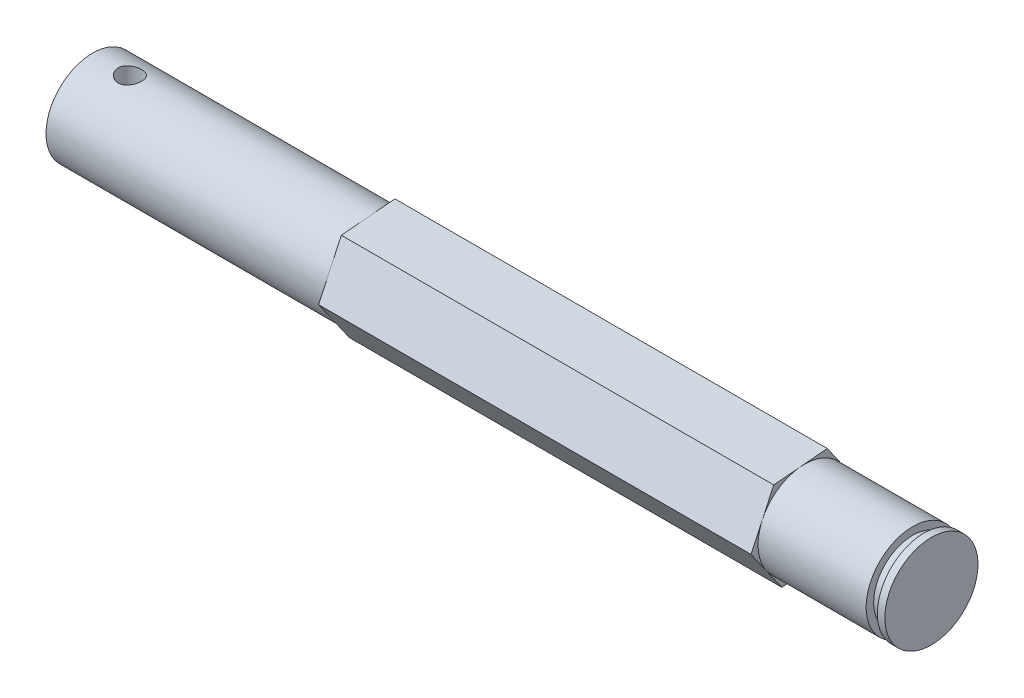
from build123d import *

# Parameters (mm, degrees)
BOSS_EXTRUDE1_DEPTH     = 38.1
SKETCH3_R               = 3.175
BOSS_EXTRUDE3_DEPTH     = 19.05
CUT_EXTRUDE1_DEPTH      = 39.418677326
CUT_EXTRUDE1_DEPTH_BACK = 39.418677326
SKETCH4_R               = 0.79375
CUT_EXTRUDE4_DEPTH      = 8.636
SKETCH6_OUTSIDE_W       = 20.904
SKETCH6_OUTSIDE_H       = 20.248
SKETCH6_OUTSIDE_R       = 2.667
CUT_EXTRUDE5_DEPTH      = 0.762


with BuildPart() as part:
    # Sketch1 → Boss-Extrude1 (new body)
    with BuildSketch(Plane(origin=(0, 0, 0), x_dir=(0, 0, -1), z_dir=(1, 0, 0))):
        Polygon((2.105028301, -3.00161443), (3.651988499, 0.32220077), (1.546960198, 3.323815199), (-2.105028301, 3.00161443), (-3.651988499, -0.32220077), (-1.546960198, -3.323815199), align=None)
    extrude(amount=BOSS_EXTRUDE1_DEPTH)

    # Sketch3 → Boss-Extrude3 (add)
    with BuildSketch(Plane.ZY):
        with Locations(Location((0, 0, 0), (0, 0, 204.958070598))):
            Circle(SKETCH3_R)
    extrude(amount=BOSS_EXTRUDE3_DEPTH)

    # Sketch4 → Cut-Extrude1 (cut, two sides: drawn at the far end of the back side and taken through both)
    with BuildSketch(Plane(origin=(0, 0, 0), x_dir=(1, 0, 0), z_dir=(0, 1, 0)).offset(-CUT_EXTRUDE1_DEPTH_BACK)):
        with Locations(Location((-16.51, 0, 0), (0, 0, 90))):
            Circle(SKETCH4_R)
    extrude(amount=CUT_EXTRUDE1_DEPTH + CUT_EXTRUDE1_DEPTH_BACK, mode=Mode.SUBTRACT)

    # Sketch5 → Cut-Extrude4 (cut)
    with BuildSketch(Plane(origin=(38.1, 0, 0), x_dir=(0, 0, -1), z_dir=(1, 0, 0))):
        with BuildLine():
            Line((-2.878508392, 1.339706848), (-2.105028301, 3.00161443))
            ThreePointArc((-2.105028301, 3.00161443), (-3.323815199, 1.546960198), (-3.651988499, -0.32220077))
            Line((-3.651988499, -0.32220077), (-2.878508392, 1.339706848))
        make_face()
        with BuildLine():
            Line((-2.878508392, 1.339706848), (-3.651988499, -0.32220077))
            Line((-3.651988499, -0.32220077), (-2.599474334, -1.823008005))
            ThreePointArc((-2.599474334, -1.823008005), (-3.162714814, -0.279034054), (-2.878508392, 1.339706848))
        make_face()
        with BuildLine():
            ThreePointArc((-3.651988499, -0.32220077), (-3.00161443, -2.105028301), (-1.546960198, -3.323815199))
            Line((-1.546960198, -3.323815199), (-2.599474334, -1.823008005))
            Line((-2.599474334, -1.823008005), (-3.651988499, -0.32220077))
        make_face()
        with BuildLine():
            Line((-2.599474334, -1.823008005), (-1.546960198, -3.323815199))
            Line((-1.546960198, -3.323815199), (0.279034067, -3.162714813))
            ThreePointArc((0.279034067, -3.162714813), (-1.339706811, -2.878508409), (-2.599474334, -1.823008005))
        make_face()
        with BuildLine():
            ThreePointArc((-1.546960198, -3.323815199), (0.32220077, -3.651988499), (2.105028301, -3.00161443))
            Line((2.105028301, -3.00161443), (0.279034067, -3.162714813))
            Line((0.279034067, -3.162714813), (-1.546960198, -3.323815199))
        make_face()
        with BuildLine():
            Line((0.279034067, -3.162714813), (2.105028301, -3.00161443))
            Line((2.105028301, -3.00161443), (2.878508392, -1.339706848))
            ThreePointArc((2.878508392, -1.339706848), (1.823007983, -2.59947435), (0.279034067, -3.162714813))
        make_face()
        with BuildLine():
            ThreePointArc((2.105028301, -3.00161443), (3.252555442, -1.69166085), (3.666174209, 0))
            ThreePointArc((3.666174209, 0), (3.662626065, 0.16125645), (3.651988499, 0.32220077))
            Line((3.651988499, 0.32220077), (2.878508392, -1.339706848))
            Line((2.878508392, -1.339706848), (2.105028301, -3.00161443))
        make_face()
        with BuildLine():
            Line((2.878508392, -1.339706848), (3.651988499, 0.32220077))
            Line((3.651988499, 0.32220077), (2.599474407, 1.823007901))
            ThreePointArc((2.599474407, 1.823007901), (3.027701789, 0.955848774), (3.175, 0))
            ThreePointArc((3.175, 0), (3.09999106, -0.686061534), (2.878508392, -1.339706848))
        make_face()
        with BuildLine():
            Line((2.599474407, 1.823007901), (3.651988499, 0.32220077))
            ThreePointArc((3.651988499, 0.32220077), (3.00161443, 2.105028301), (1.546960198, 3.323815199))
            Line((1.546960198, 3.323815199), (2.599474407, 1.823007901))
        make_face()
        with BuildLine():
            Line((2.599474407, 1.823007901), (1.546960198, 3.323815199))
            Line((1.546960198, 3.323815199), (-0.279034067, 3.162714813))
            ThreePointArc((-0.279034067, 3.162714813), (1.339706869, 2.878508382), (2.599474407, 1.823007901))
        make_face()
        with BuildLine():
            Line((-0.279034067, 3.162714813), (1.546960198, 3.323815199))
            ThreePointArc((1.546960198, 3.323815199), (-0.32220077, 3.651988499), (-2.105028301, 3.00161443))
            Line((-2.105028301, 3.00161443), (-0.279034067, 3.162714813))
        make_face()
        with BuildLine():
            Line((-0.279034067, 3.162714813), (-2.105028301, 3.00161443))
            Line((-2.105028301, 3.00161443), (-2.878508392, 1.339706848))
            ThreePointArc((-2.878508392, 1.339706848), (-1.823007983, 2.59947435), (-0.279034067, 3.162714813))
        make_face()
    extrude(amount=-CUT_EXTRUDE4_DEPTH, mode=Mode.SUBTRACT)

    # Sketch6 outside → Cut-Extrude5 (cut)
    with BuildSketch(Plane(origin=(36.83, 0, 0), x_dir=(0, 0, -1), z_dir=(1, 0, 0))):
        Rectangle(SKETCH6_OUTSIDE_W, SKETCH6_OUTSIDE_H)
        with Locations(Location((0, 0, 0), (0, 0, 180))):
            Circle(SKETCH6_OUTSIDE_R, mode=Mode.SUBTRACT)
    extrude(amount=CUT_EXTRUDE5_DEPTH, mode=Mode.SUBTRACT)


solid = part.part
